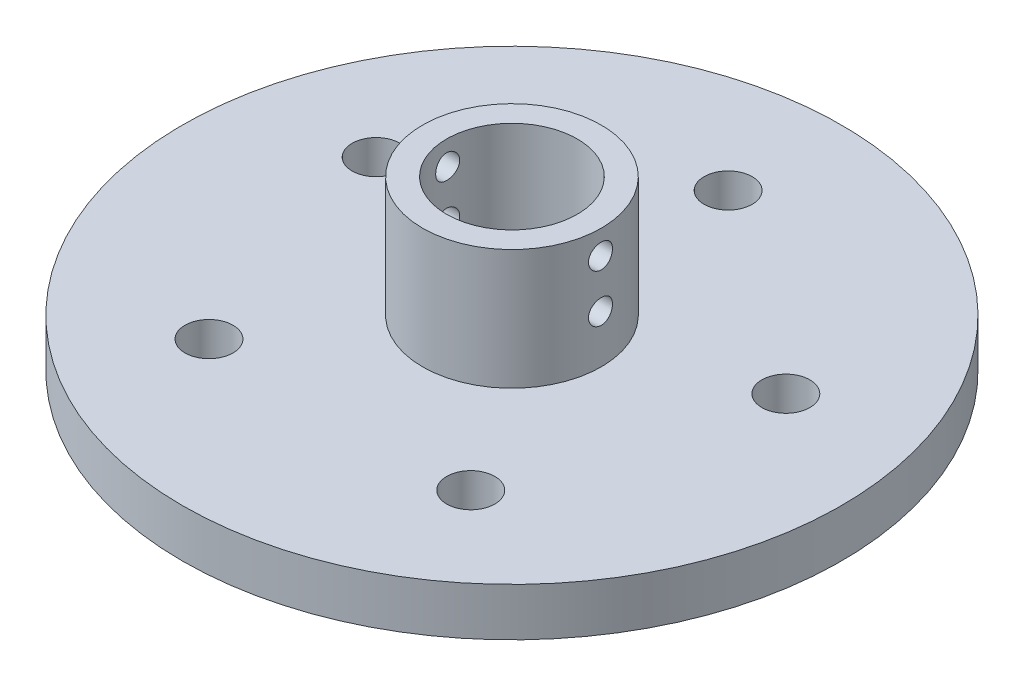
from build123d import *

# Parameters (mm, degrees)
SKETCH1_W                            = 6.35
SKETCH1_H                            = 31.75
SKETCH1_W_2                          = 69.85
SKETCH1_H_2                          = 12.7
F_1_2_20_TAPPED_HOLE1_D              = 12.7
SKETCH7_W                            = 3.175
SKETCH7_H                            = 87.122
F_1_4_0_25_DIAMETER_HOLE1_AT_2_COUNT = 2
F_1_4_0_25_DIAMETER_HOLE1_AT_2_PITCH = 12.7
F_1_4_0_25_DIAMETER_HOLE2_D          = 6.35


with BuildPart() as part:
    # Sketch1 → Revolve1 (revolve)
    with BuildSketch(Plane.XY, mode=Mode.PRIVATE) as revolve1_sk:
        with Locations((20.447, 28.575)):
            Rectangle(SKETCH1_W, SKETCH1_H)
        with Locations((52.197, 6.35)):
            Rectangle(SKETCH1_W_2, SKETCH1_H_2)
    revolve(revolve1_sk.sketch.rotate(Axis((0, 7.809475806, 0), (0, -1, 0)), 90), axis=Axis((0, 7.809475806, 0), (0, -1, 0)))

    # 1/2-20 Tapped Hole1 (through all)
    with Locations(Plane(origin=(0, 12.7, 0), x_dir=(1, 0, 0), z_dir=(0, 1, 0))):
        with Locations((-54.155626078, 18.25625), (0, 57.15), (54.155626078, 18.25625), (34.599427772, -45.486284722), (-34.599427772, -45.486284722)):
            Hole(F_1_2_20_TAPPED_HOLE1_D / 2)

    # Sketch7 → 1/4 (0.25) Diameter Hole1 (revolve, cut)
    with BuildSketch(Plane.ZX.offset(38.1)):
        with Locations((1.5875, 43.561)):
            Rectangle(SKETCH7_W, SKETCH7_H)
    f_1_4_0_25_diameter_hole1 = revolve(axis=Axis((-6.35, 38.1, 0), (1, 0, 0)), mode=Mode.SUBTRACT)

    # 1/4 (0.25) Diameter Hole1 at 2: 1/4 (0.25) Diameter Hole1 ×2
    with Locations(*[(0, -i * F_1_4_0_25_DIAMETER_HOLE1_AT_2_PITCH, 0) for i in range(1, F_1_4_0_25_DIAMETER_HOLE1_AT_2_COUNT)]):
        add(f_1_4_0_25_diameter_hole1, mode=Mode.SUBTRACT)

    # 1/4 (0.25) Diameter Hole2 (through all)
    with Locations(Plane(origin=(0, 0, 0), x_dir=(0, 0, -1), z_dir=(1, 0, 0))):
        with Locations((0, 38.1), (0, 25.4)):
            Hole(F_1_4_0_25_DIAMETER_HOLE2_D / 2)


solid = part.part
